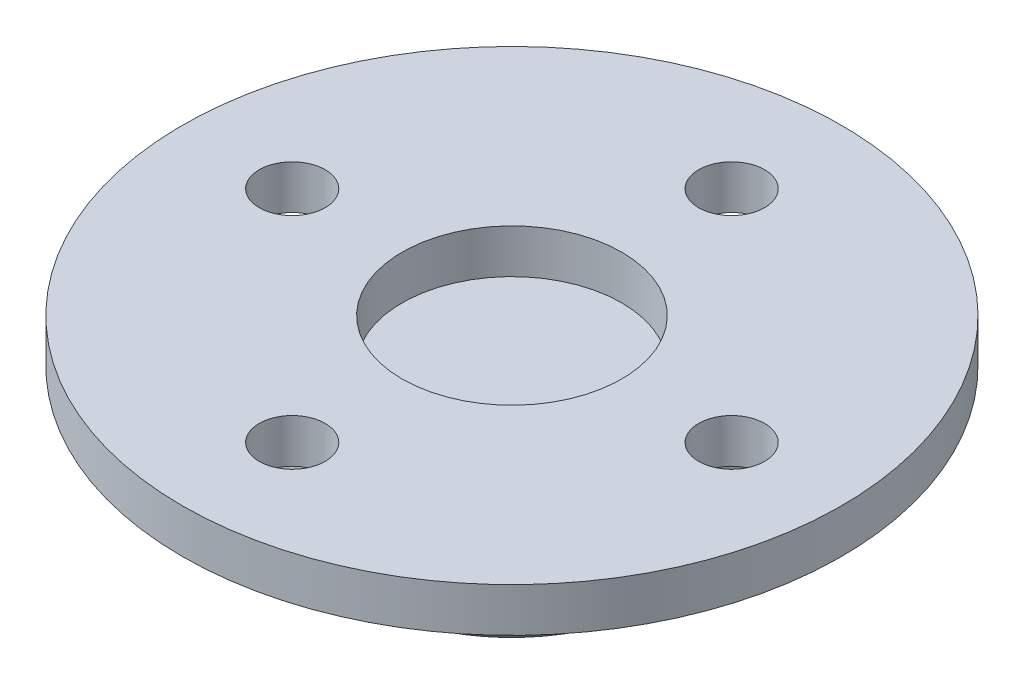
from build123d import *

# Parameters (mm, degrees)
SKETCH2_R           = 19.05
SKETCH2_R_2         = 6.35
SKETCH2_R_3         = 1.905
BOSS_EXTRUDE1_DEPTH = 2.54
SKETCH3_R           = 10.16
BOSS_EXTRUDE2_DEPTH = 7.62
FILLET1_R           = 2.54


with BuildPart() as part:
    # Sketch2 → Boss-Extrude1 (new body)
    with BuildSketch(Plane(origin=(0, 0, 0), x_dir=(1, 0, 0), z_dir=(0, 1, 0))):
        with Locations(Location((0, 0, 0), (0, 0, 270))):
            Circle(SKETCH2_R)
        with Locations(Location((0, 0, 0), (0, 0, 270))):
            Circle(SKETCH2_R_2, mode=Mode.SUBTRACT)
        with Locations(Location((0, 12.7, 0), (0, 0, 270))):
            Circle(SKETCH2_R_3, mode=Mode.SUBTRACT)
        with Locations(Location((12.7, 0, 0), (0, 0, 270))):
            Circle(SKETCH2_R_3, mode=Mode.SUBTRACT)
        with Locations(Location((0, -12.7, 0), (0, 0, 270))):
            Circle(SKETCH2_R_3, mode=Mode.SUBTRACT)
        with Locations(Location((-12.7, 0, 0), (0, 0, 270))):
            Circle(SKETCH2_R_3, mode=Mode.SUBTRACT)
    extrude(amount=-BOSS_EXTRUDE1_DEPTH)

    # Sketch3 → Boss-Extrude2 (add)
    with BuildSketch(Plane.XZ.offset(2.54)):
        with Locations(Location((0, 0, 0), (0, 0, 90))):
            Circle(SKETCH3_R)
    extrude(amount=BOSS_EXTRUDE2_DEPTH)

    # Fillet1
    fillet1_edges = [part.edges().sort_by_distance(p)[0] for p in [
        (0, -10.16, -10.16),
    ]]
    fillet(fillet1_edges, radius=FILLET1_R)


with BuildPart() as body_2:
    # Sketch5 → Revolve1 (revolve)
    with BuildSketch(Plane.XZ.offset(10.16)):
        with BuildLine():
            Line((0, 6.35), (0, -6.35))
            ThreePointArc((0, -6.35), (6.35, 0), (0, 6.35))
        make_face()
    revolve(axis=Axis((0, -10.16, -11.766022755), (0, 0, 1)))


with BuildPart() as part_1:
    add(part.part)

    # Combine1: cut body 2
    add(body_2.part, mode=Mode.SUBTRACT)


solid = part_1.part
